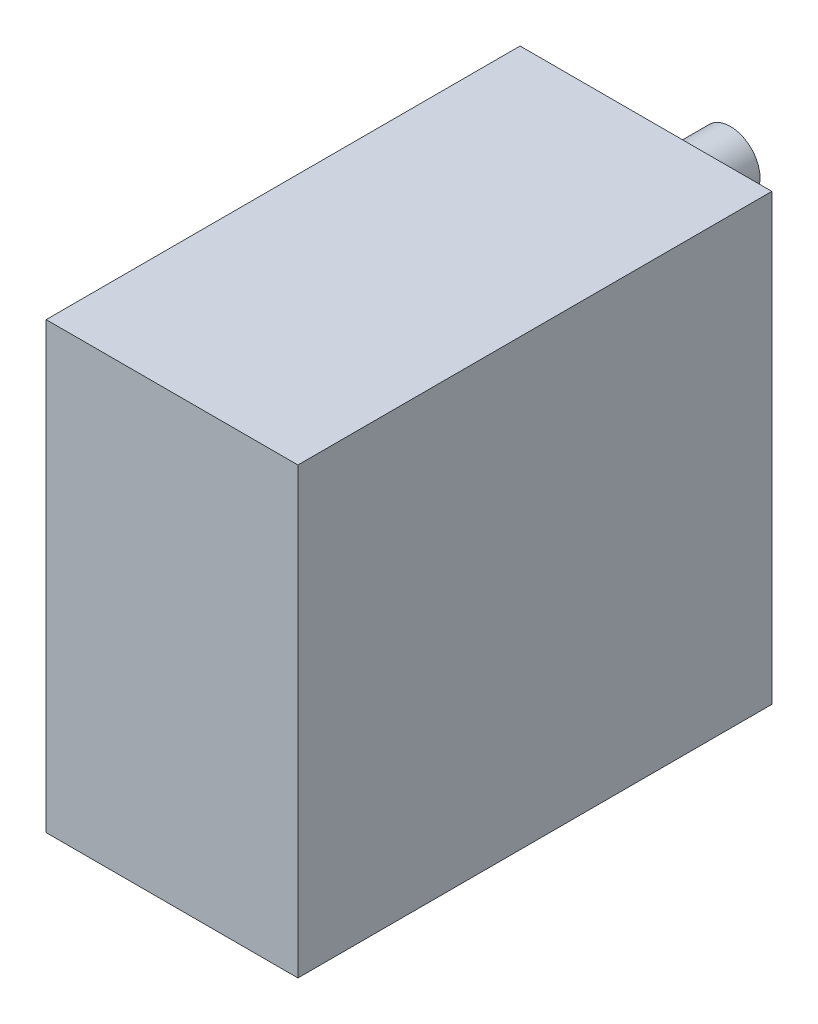
from build123d import *

# Parameters (mm, degrees)
SKETCH3_W           = 170
SKETCH3_H           = 320
BOSS_EXTRUDE2_DEPTH = 300
SKETCH6_R           = 20
SKETCH6_R_2         = 15
BOSS_EXTRUDE4_DEPTH = 57


with BuildPart() as part:
    # Sketch3 → Boss-Extrude2 (new body)
    with BuildSketch(Plane(origin=(0, 0, 0), x_dir=(1, 0, 0), z_dir=(0, 1, 0))):
        with Locations((-59.615269212, 34.820736789)):
            Rectangle(SKETCH3_W, SKETCH3_H)
    extrude(amount=BOSS_EXTRUDE2_DEPTH)

    # Sketch6 → Boss-Extrude4 (add)
    with BuildSketch(Plane(origin=(0, 0, -194.820736789), x_dir=(-1, 0, 0), z_dir=(0, 0, -1))):
        with Locations(Location((59.615269212, 247, 0), (0, 0, 180))):
            Circle(SKETCH6_R)
        with Locations(Location((59.615269212, 247, 0), (0, 0, 180))):
            Circle(SKETCH6_R_2, mode=Mode.SUBTRACT)
    extrude(amount=BOSS_EXTRUDE4_DEPTH)


solid = part.part
